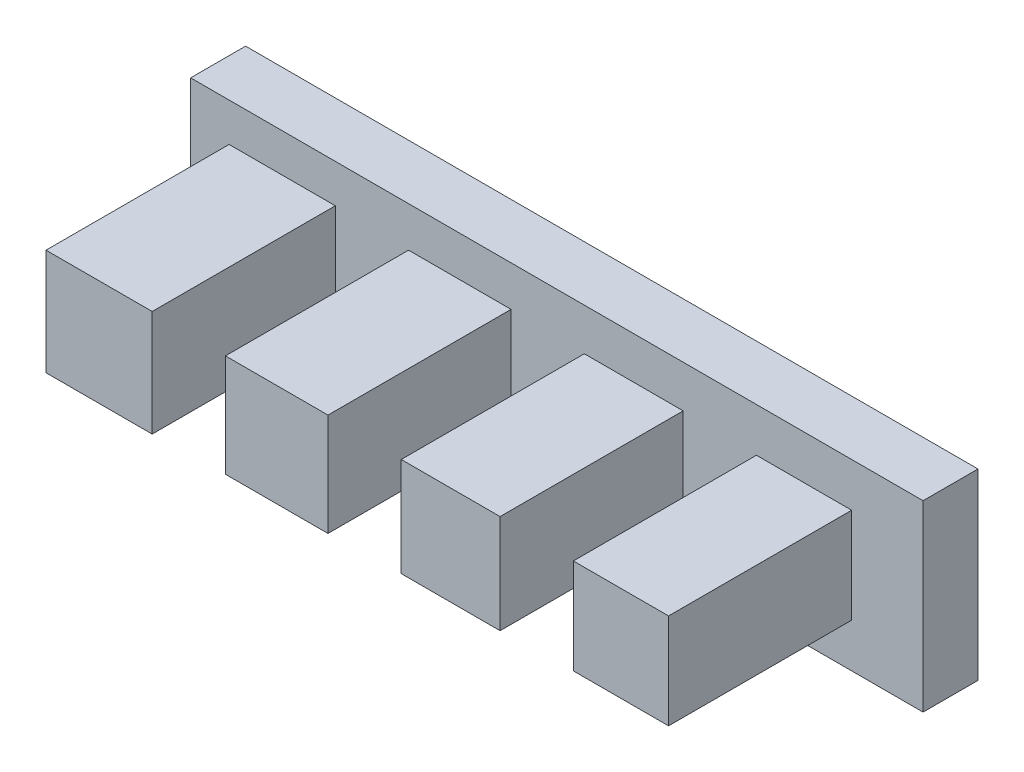
from build123d import *

# Parameters (mm, degrees)
SKETCH1_W           = 20
SKETCH1_H           = 5
BOSS_EXTRUDE1_DEPTH = 1.5
SKETCH2_W           = 2.9
SKETCH2_H           = 2.9
SKETCH2_W_2         = 2.8
SKETCH2_H_2         = 2.8
SKETCH2_W_3         = 2.7
SKETCH2_H_3         = 2.7
SKETCH2_W_4         = 2.6
SKETCH2_H_4         = 2.6
BOSS_EXTRUDE2_DEPTH = 5


with BuildPart() as part:
    # Sketch1 → Boss-Extrude1 (new body)
    with BuildSketch(Plane.XY):
        with Locations((10, 2.5)):
            Rectangle(SKETCH1_W, SKETCH1_H)
    extrude(amount=BOSS_EXTRUDE1_DEPTH)

    # Sketch2 → Boss-Extrude2 (add)
    with BuildSketch(Plane.XY.offset(1.5)):
        with Locations((2.5, 2.5)):
            Rectangle(SKETCH2_W, SKETCH2_H)
        with Locations((7.35, 2.5)):
            Rectangle(SKETCH2_W_2, SKETCH2_H_2)
        with Locations((12.1, 2.5)):
            Rectangle(SKETCH2_W_3, SKETCH2_H_3)
        with Locations((16.75, 2.5)):
            Rectangle(SKETCH2_W_4, SKETCH2_H_4)
    extrude(amount=BOSS_EXTRUDE2_DEPTH)


solid = part.part
